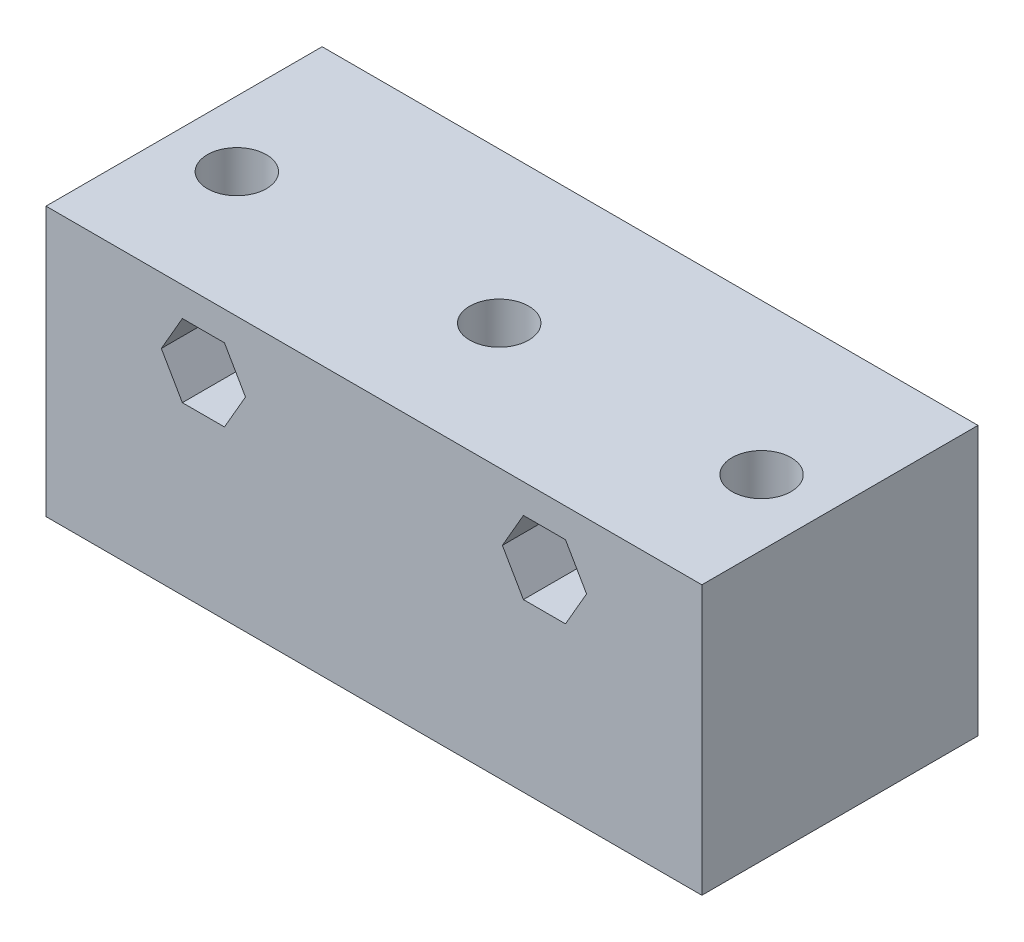
from build123d import *

# Parameters (mm, degrees)
SKETCH1_W           = 100
SKETCH1_H           = 41
BOSS_EXTRUDE1_DEPTH = 42.1
SKETCH2_R           = 4.5
CUT_EXTRUDE1_DEPTH  = 41
SKETCH1_3_R         = 4.5
BOSS_EXTRUDE2_DEPTH = 10


with BuildPart() as part:
    # Sketch1 → Boss-Extrude1 (new body)
    with BuildSketch(Plane.XY):
        with Locations((50, -20.5)):
            Rectangle(SKETCH1_W, SKETCH1_H)
        Polygon((79.207902433, -4.44375), (72.792097567, -4.44375), (69.584195134, -10), (72.792097567, -15.55625), (79.207902433, -15.55625), (82.415804866, -10), align=None, mode=Mode.SUBTRACT)
        Polygon((20.792097567, -15.55625), (17.584195134, -10), (20.792097567, -4.44375), (27.207902433, -4.44375), (30.415804866, -10), (27.207902433, -15.55625), align=None, mode=Mode.SUBTRACT)
    extrude(amount=BOSS_EXTRUDE1_DEPTH)

    # Sketch2 → Cut-Extrude1 (cut)
    with BuildSketch(Plane(origin=(0, 0, 0), x_dir=(-1, 0, 0), z_dir=(0, -1, 0))):
        with Locations(Location((-10, -23, 0), (0, 0, 270))):
            Circle(SKETCH2_R)
        with Locations(Location((-50, -23, 0), (0, 0, 270))):
            Circle(SKETCH2_R)
        with Locations(Location((-90, -23, 0), (0, 0, 270))):
            Circle(SKETCH2_R)
    extrude(amount=CUT_EXTRUDE1_DEPTH, mode=Mode.SUBTRACT)

    # Sketch1<3> → Boss-Extrude2 (add)
    # profile 1 of 2: a face of its own
    with BuildSketch(Plane.XY):
        Polygon((27.207902433, -4.44375), (20.792097567, -4.44375), (17.584195134, -10), (20.792097567, -15.55625), (27.207902433, -15.55625), (30.415804866, -10), align=None)
        with Locations((24, -10)):
            Circle(SKETCH1_3_R, mode=Mode.SUBTRACT)
    # profile 2 of 2: a face of its own
    with BuildSketch(Plane.XY):
        Polygon((79.207902433, -15.55625), (82.415804866, -10), (79.207902433, -4.44375), (72.792097567, -4.44375), (69.584195134, -10), (72.792097567, -15.55625), align=None)
        with Locations((76, -10)):
            Circle(SKETCH1_3_R, mode=Mode.SUBTRACT)
    extrude(amount=BOSS_EXTRUDE2_DEPTH)


solid = part.part
